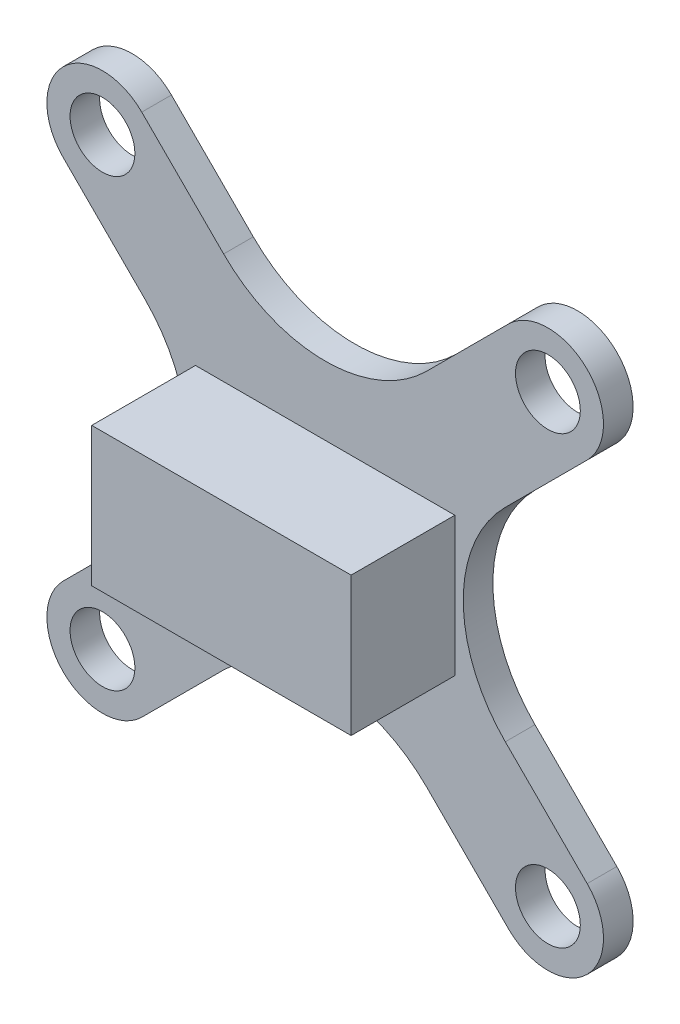
from build123d import *

# Parameters (mm, degrees)
SKETCH1_R           = 1.75
SKETCH1_W           = 5
SKETCH1_H           = 4
BOSS_EXTRUDE1_DEPTH = 1.6
SKETCH1_3_W         = 14
SKETCH1_3_H         = 7.5
BOSS_EXTRUDE2_DEPTH = 7.2
SKETCH1_5_W         = 5
SKETCH1_5_H         = 4
BOSS_EXTRUDE3_DEPTH = 1.7


with BuildPart() as part:
    # Sketch1 → Boss-Extrude1 (new body)
    with BuildSketch(Plane.XY):
        with BuildLine():
            Line((-14.142135624, 9.899494937), (-9.722718241, 5.480077554))
            ThreePointArc((-9.722718241, 5.480077554), (-7.452795796, 0), (-9.722718241, -5.480077554))
            Line((-9.722718241, -5.480077554), (-14.142135624, -9.899494937))
            ThreePointArc((-14.142135624, -9.899494937), (-14.142135624, -14.142135624), (-9.899494937, -14.142135624))
            Line((-9.899494937, -14.142135624), (-5.480077554, -9.722718241))
            ThreePointArc((-5.480077554, -9.722718241), (0, -7.452795796), (5.480077554, -9.722718241))
            Line((5.480077554, -9.722718241), (9.899494937, -14.142135624))
            ThreePointArc((9.899494937, -14.142135624), (14.142135624, -14.142135624), (14.142135624, -9.899494937))
            Line((14.142135624, -9.899494937), (9.722718241, -5.480077554))
            ThreePointArc((9.722718241, -5.480077554), (7.452795796, 0), (9.722718241, 5.480077554))
            Line((9.722718241, 5.480077554), (14.142135624, 9.899494937))
            ThreePointArc((14.142135624, 9.899494937), (14.142135624, 14.142135624), (9.899494937, 14.142135624))
            Line((9.899494937, 14.142135624), (5.480077554, 9.722718241))
            ThreePointArc((5.480077554, 9.722718241), (0, 7.452795796), (-5.480077554, 9.722718241))
            Line((-5.480077554, 9.722718241), (-9.899494937, 14.142135624))
            ThreePointArc((-9.899494937, 14.142135624), (-14.142135624, 14.142135624), (-14.142135624, 9.899494937))
        make_face()
        with Locations((-12.02081528, -12.02081528)):
            Circle(SKETCH1_R, mode=Mode.SUBTRACT)
        with Locations((12.02081528, -12.02081528)):
            Circle(SKETCH1_R, mode=Mode.SUBTRACT)
        with Locations((-12.02081528, 12.02081528)):
            Circle(SKETCH1_R, mode=Mode.SUBTRACT)
        with Locations((12.02081528, 12.02081528)):
            Circle(SKETCH1_R, mode=Mode.SUBTRACT)
        Rectangle(SKETCH1_W, SKETCH1_H, mode=Mode.SUBTRACT)
    extrude(amount=BOSS_EXTRUDE1_DEPTH)

    # Sketch1<3> → Boss-Extrude2 (add)
    with BuildSketch(Plane.XY):
        Rectangle(SKETCH1_3_W, SKETCH1_3_H)
    extrude(amount=BOSS_EXTRUDE2_DEPTH)

    # Sketch1<5> → Boss-Extrude3 (add)
    with BuildSketch(Plane.XY):
        Rectangle(SKETCH1_5_W, SKETCH1_5_H)
    extrude(amount=-BOSS_EXTRUDE3_DEPTH)


solid = part.part
